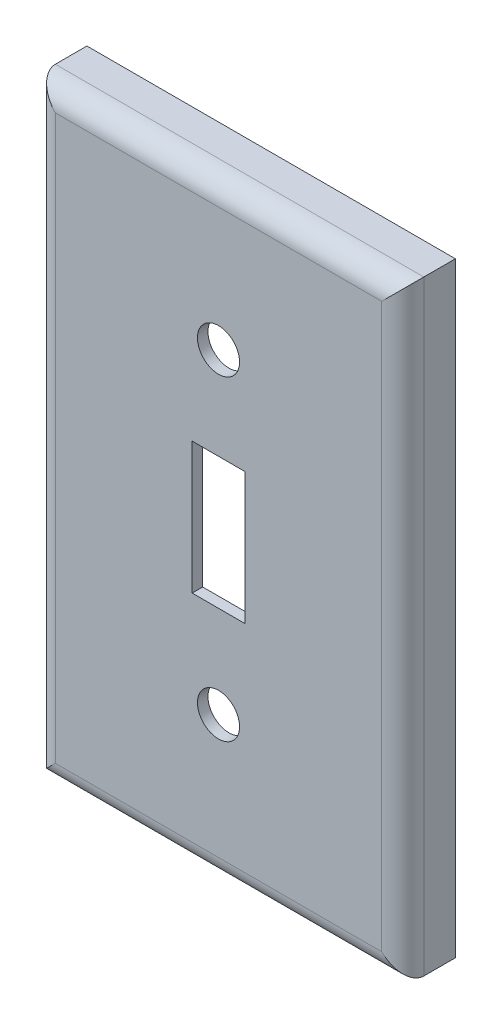
from build123d import *

# Parameters (mm, degrees)
CROQUIS2_W              = 70
CROQUIS2_H              = 115
SALIENTE_EXTRUIR1_DEPTH = 10
REDONDEO1_R             = 4
VACIADO1_T              = -2
CROQUIS3_R              = 4
CROQUIS3_W              = 10
CROQUIS3_H              = 25
CORTAR_EXTRUIR1_DEPTH   = 10


with BuildPart() as part:
    # Croquis2 → Saliente-Extruir1 (new body)
    with BuildSketch(Plane.XY):
        with Locations((35, 57.5)):
            Rectangle(CROQUIS2_W, CROQUIS2_H)
    extrude(amount=SALIENTE_EXTRUIR1_DEPTH)

    # Redondeo1
    redondeo1_edges = [part.edges().sort_by_distance(p)[0] for p in [
        (70, 57.5, 10),
        (35, 115, 10),
        (0, 57.5, 10),
        (35, 0, 10),
    ]]
    fillet(redondeo1_edges, radius=REDONDEO1_R)

    # Vaciado1
    vaciado1_openings = [part.faces().sort_by_distance(p)[0] for p in [
        (35, 57.5, 0),
    ]]
    offset(amount=VACIADO1_T, openings=vaciado1_openings)

    # Croquis3 → Cortar-Extruir1 (cut)
    with BuildSketch(Plane.XY.offset(10)):
        with Locations((35, 87.5)):
            Circle(CROQUIS3_R)
        with Locations((35, 27.5)):
            Circle(CROQUIS3_R)
        with Locations((35, 57.5)):
            Rectangle(CROQUIS3_W, CROQUIS3_H)
    extrude(amount=-CORTAR_EXTRUIR1_DEPTH, mode=Mode.SUBTRACT)


solid = part.part
